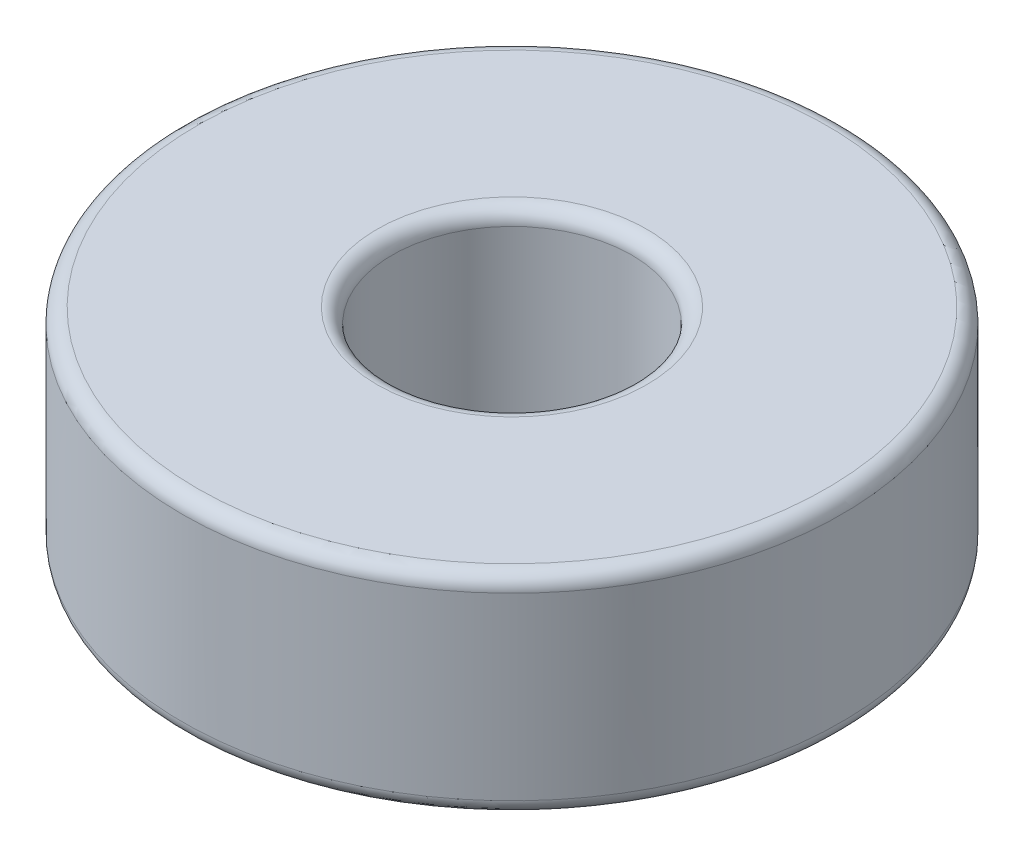
from build123d import *

# Parameters (mm, degrees)
ESQUISSE1_W = 7
ESQUISSE1_H = 7
CONG_1_R    = 0.5


with BuildPart() as part:
    # Esquisse1 → Révolution1 (revolve)
    with BuildSketch(Plane.XY, mode=Mode.PRIVATE) as r_volution1_sk:
        with Locations((7.5, 3.5)):
            Rectangle(ESQUISSE1_W, ESQUISSE1_H)
    revolve(r_volution1_sk.sketch.rotate(Axis((0, 0, 0), (0, 1, 0)), 90), axis=Axis((0, 0, 0), (0, 1, 0)))

    # Congé1
    cong_1_edges = [part.edges().sort_by_distance(p)[0] for p in [
        (0, 0, 4),
        (0, 0, 11),
        (0, 7, 11),
        (0, 7, 4),
    ]]
    fillet(cong_1_edges, radius=CONG_1_R)


solid = part.part
